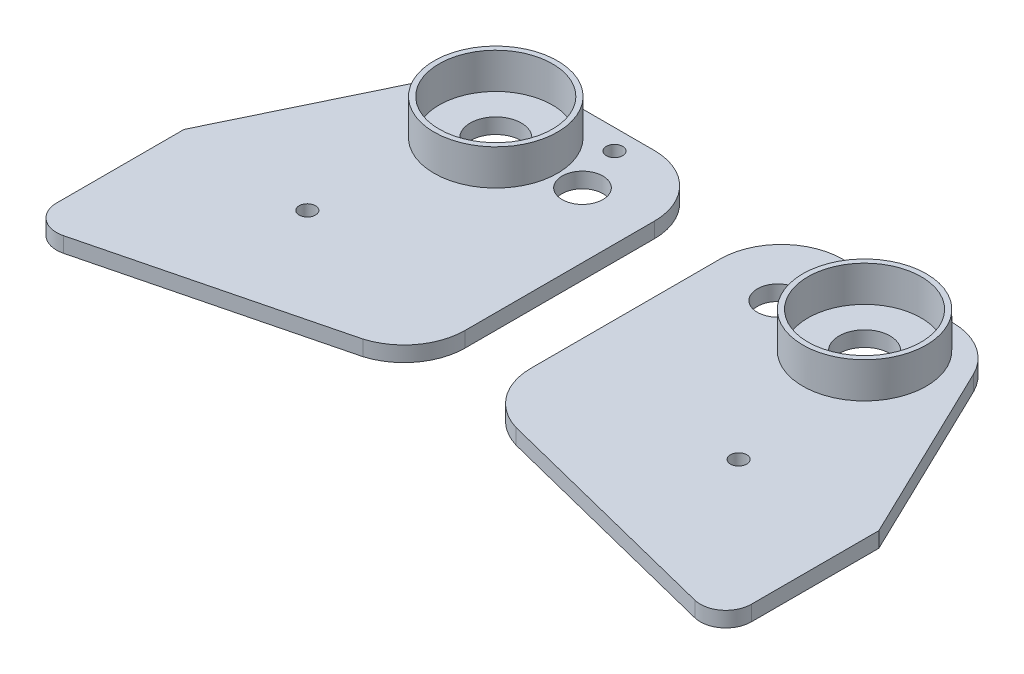
from build123d import *

# Parameters (mm, degrees)
IZIM1_R                       = 5
IZIM1_R_2                     = 4
IZIM1_R_3                     = 1.6
Y_KSEKLIK_EKSTR_ZYON2_DEPTH   = 3
Y_KSEKLIK_EKSTR_ZYON2_2_DEPTH = 3
IZIM2_R                       = 12.1
IZIM2_R_2                     = 11.1
Y_KSEKLIK_EKSTR_ZYON3_DEPTH   = 7
IZIM3_R                       = 12.1
IZIM3_R_2                     = 11.1
Y_KSEKLIK_EKSTR_ZYON4_DEPTH   = 7
IZIM4_R                       = 1.6
KES_EKSTR_ZYON1_DEPTH         = 82.484022533
IZIM5_R                       = 1.6
KES_EKSTR_ZYON2_DEPTH         = 82.484022533


with BuildPart() as part:
    # Çizim1 → Yükseklik-Ekstrüzyon2 (new body)
    with BuildSketch(Plane(origin=(0, 0, 0), x_dir=(1, 0, 0), z_dir=(0, 1, 0))):
        with BuildLine():
            Line((-68.084299237, 1.703943313), (-68.084797964, -23.286509948))
            ThreePointArc((-68.084797964, -23.286509948), (-66.158876869, -27.229963494), (-61.864685641, -28.135457628))
            Line((-61.864685641, -28.135457628), (-14.999890892, -16.342900955))
            ThreePointArc((-14.999890892, -16.342900955), (-8.811960476, -12.013704596), (-6.435524315, -4.845373191))
            Line((-6.435524315, -4.845373191), (-6.435446445, 1.690953534))
            Line((-6.435446445, 1.690953534), (-6.435084331, 32.216193937))
            ThreePointArc((-6.435084331, 32.216193937), (-9.949698317, 40.70150849), (-18.434929196, 44.216326031))
            Line((-18.434929196, 44.216326031), (-40.042731838, 44.216583023))
            ThreePointArc((-40.042731838, 44.216583023), (-46.336600031, 42.43367707), (-50.760203342, 37.61462486))
            Line((-50.760203342, 37.61462486), (-68.084299237, 1.703943313))
        make_face()
        with Locations(Location((-36.135474475, 30.846047168, 0), (0, 0, 270))):
            Circle(IZIM1_R, mode=Mode.SUBTRACT)
        with Locations(Location((-19.13547597, 30.841945567, 0), (0, 0, 270))):
            Circle(IZIM1_R_2, mode=Mode.SUBTRACT)
        with Locations(Location((-42.260458863, 0.041620293, 0), (0, 0, 270))):
            Circle(IZIM1_R_3, mode=Mode.SUBTRACT)
    extrude(amount=Y_KSEKLIK_EKSTR_ZYON2_DEPTH)

    # Çizim2 → Yükseklik-Ekstrüzyon3 (add)
    with BuildSketch(Plane(origin=(0, 3, 0), x_dir=(1, 0, 0), z_dir=(0, 1, 0))):
        with Locations(Location((-36.135474475, 30.846047168, 0), (0, 0, 270))):
            Circle(IZIM2_R)
        with Locations(Location((-36.135474475, 30.846047168, 0), (0, 0, 270))):
            Circle(IZIM2_R_2, mode=Mode.SUBTRACT)
    extrude(amount=Y_KSEKLIK_EKSTR_ZYON3_DEPTH)

    # Çizim4 → Kes-Ekstrüzyon1 (cut, through all)
    with BuildSketch(Plane(origin=(0, 3, 0), x_dir=(1, 0, 0), z_dir=(0, 1, 0))):
        with Locations(Location((-22.238830517, 40.216371272, 0), (0, 0, 270))):
            Circle(IZIM4_R)
    extrude(amount=-KES_EKSTR_ZYON1_DEPTH, mode=Mode.SUBTRACT)


with BuildPart() as body_2:
    # Çizim1 → Y_kseklik-Ekstr_zyon2 2 (new body)
    with BuildSketch(Plane(origin=(0, 0, 0), x_dir=(1, 0, 0), z_dir=(0, 1, 0))):
        with BuildLine():
            Line((50.760203342, 37.61462486), (68.084299237, 1.703943313))
            Line((68.084299237, 1.703943313), (68.084797964, -23.286509948))
            ThreePointArc((68.084797964, -23.286509948), (66.158876869, -27.229963494), (61.864685641, -28.135457628))
            Line((61.864685641, -28.135457628), (14.999890892, -16.342900955))
            ThreePointArc((14.999890892, -16.342900955), (8.811960476, -12.013704596), (6.435524315, -4.845373191))
            Line((6.435524315, -4.845373191), (6.435446445, 1.690953534))
            Line((6.435446445, 1.690953534), (6.435084331, 32.216193937))
            ThreePointArc((6.435084331, 32.216193937), (9.949698317, 40.70150849), (18.434929196, 44.216326031))
            Line((18.434929196, 44.216326031), (40.042731838, 44.216583023))
            ThreePointArc((40.042731838, 44.216583023), (46.336600031, 42.43367707), (50.760203342, 37.61462486))
        make_face()
        with Locations(Location((42.260458863, 0.041620293, 0), (0, 0, 90))):
            Circle(IZIM1_R_3, mode=Mode.SUBTRACT)
        with Locations(Location((19.13547597, 30.841945567, 0), (0, 0, 90))):
            Circle(IZIM1_R_2, mode=Mode.SUBTRACT)
        with Locations(Location((36.135474475, 30.846047168, 0), (0, 0, 90))):
            Circle(IZIM1_R, mode=Mode.SUBTRACT)
    extrude(amount=Y_KSEKLIK_EKSTR_ZYON2_2_DEPTH)

    # Çizim3 → Yükseklik-Ekstrüzyon4 (add)
    with BuildSketch(Plane(origin=(0, 3, 0), x_dir=(1, 0, 0), z_dir=(0, 1, 0))):
        with Locations(Location((36.135474475, 30.846047168, 0), (0, 0, 90))):
            Circle(IZIM3_R)
        with Locations(Location((36.135474475, 30.846047168, 0), (0, 0, 270))):
            Circle(IZIM3_R_2, mode=Mode.SUBTRACT)
    extrude(amount=Y_KSEKLIK_EKSTR_ZYON4_DEPTH)

    # Çizim5 → Kes-Ekstrüzyon2 (cut, through all)
    with BuildSketch(Plane(origin=(0, 3, 0), x_dir=(1, 0, 0), z_dir=(0, 1, 0))):
        with Locations(Location((22.238830517, 40.216371272, 0), (0, 0, 270))):
            Circle(IZIM5_R)
    extrude(amount=-KES_EKSTR_ZYON2_DEPTH, mode=Mode.SUBTRACT)


solid = Compound([part.part, body_2.part])
